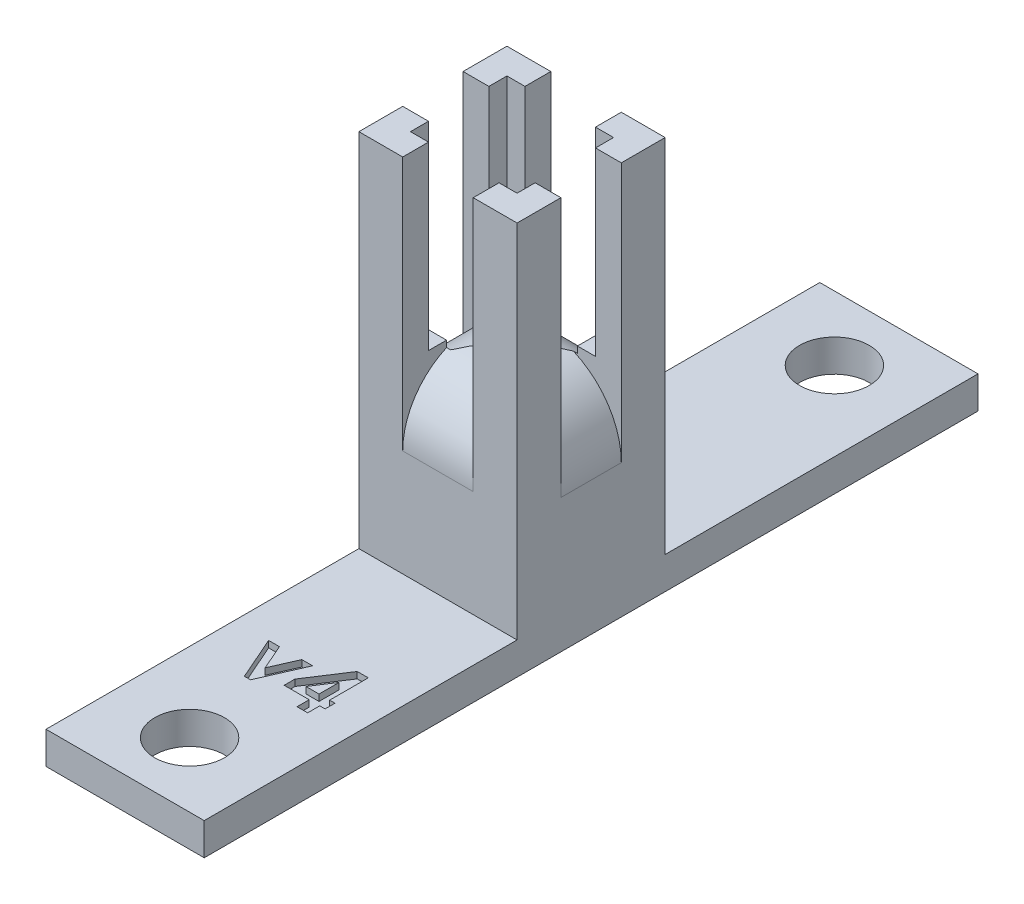
from build123d import *

# Parameters (mm, degrees)
BOSS_EXTRUDE1_DEPTH            = 17.78
BOSS_EXTRUDE1_2_DEPTH          = 17.78
BOSS_EXTRUDE1_3_DEPTH          = 17.78
BOSS_EXTRUDE1_4_DEPTH          = 17.78
SKETCH2_W                      = 15.58
SKETCH2_H                      = 14.58
BOSS_EXTRUDE2_DEPTH            = 17.78
SKETCH3_W                      = 15.58
SKETCH3_H                      = 76.2
SKETCH3_R                      = 3.429
BOSS_EXTRUDE3_DEPTH            = 3.175
CUT_EXTRUDE3_DEPTH             = 0.635
CUT_EXTRUDE4_REACH             = 46.175
CUT_EXTRUDE4_DIRECTION_2_REACH = 46.175
CUT_EXTRUDE5_REACH             = 46.175
CUT_EXTRUDE5_DIRECTION_2_REACH = 46.175


with BuildPart() as part:
    # Sketch1 → Boss-Extrude1 (new body)
    with BuildSketch(Plane(origin=(0, 0, 0), x_dir=(1, 0, 0), z_dir=(0, 1, 0))):
        Polygon((-5.25, 4.75), (-5.25, 2.972), (-7.79, 2.972), (-7.79, 7.29), (-3.472, 7.29), (-3.472, 4.75), align=None)
    extrude(amount=BOSS_EXTRUDE1_DEPTH)



with BuildPart() as body_2:
    # Sketch1 → Boss-Extrude1 2 (new body)
    with BuildSketch(Plane(origin=(0, 0, 0), x_dir=(1, 0, 0), z_dir=(0, 1, 0))):
        Polygon((7.79, 2.972), (7.79, 7.29), (3.472, 7.29), (3.472, 4.75), (5.25, 4.75), (5.25, 2.972), align=None)
    extrude(amount=BOSS_EXTRUDE1_2_DEPTH)


with BuildPart() as body_3:
    # Sketch1 → Boss-Extrude1 3 (new body)
    with BuildSketch(Plane(origin=(0, 0, 0), x_dir=(1, 0, 0), z_dir=(0, 1, 0))):
        Polygon((5.25, -2.972), (7.79, -2.972), (7.79, -7.29), (3.472, -7.29), (3.472, -4.75), (5.25, -4.75), align=None)
    extrude(amount=BOSS_EXTRUDE1_3_DEPTH)


with BuildPart() as body_4:
    # Sketch1 → Boss-Extrude1 4 (new body)
    with BuildSketch(Plane(origin=(0, 0, 0), x_dir=(1, 0, 0), z_dir=(0, 1, 0))):
        Polygon((-5.25, -2.972), (-7.79, -2.972), (-7.79, -7.29), (-3.472, -7.29), (-3.472, -4.75), (-5.25, -4.75), align=None)
    extrude(amount=BOSS_EXTRUDE1_4_DEPTH)


with BuildPart() as part_1:
    add(part.part)

    add(body_2.part)  # Boss-Extrude2 merges body 2

    add(body_3.part)  # Boss-Extrude2 merges body 3

    add(body_4.part)  # Boss-Extrude2 merges body 4
    # Sketch2 → Boss-Extrude2 (add)
    with BuildSketch(Plane(origin=(0, 0, 0), x_dir=(-1, 0, 0), z_dir=(0, -1, 0))):
        Rectangle(SKETCH2_W, SKETCH2_H)
    extrude(amount=BOSS_EXTRUDE2_DEPTH)

    # Sketch3 → Boss-Extrude3 (add)
    with BuildSketch(Plane(origin=(0, -17.78, 0), x_dir=(-1, 0, 0), z_dir=(0, -1, 0))):
        Rectangle(SKETCH3_W, SKETCH3_H)
        with Locations(Location((0, 31.75, 0), (0, 0, 90))):
            Circle(SKETCH3_R, mode=Mode.SUBTRACT)
        with Locations(Location((0, -31.75, 0), (0, 0, 270))):
            Circle(SKETCH3_R, mode=Mode.SUBTRACT)
    extrude(amount=BOSS_EXTRUDE3_DEPTH)

    # Sketch5 → Cut-Extrude3 (cut)
    # profile 1 of 2: a face of its own
    with BuildSketch(Plane(origin=(0, -17.78, 0), x_dir=(1, 0, 0), z_dir=(0, 1, 0))):
        Polygon((-4.402938034, -19.56265828), (-3.33951656, -19.56265828), (-2.238782051, -22.073125862), (-1.138047543, -19.56265828), (-0.074626068, -19.56265828), (-1.937945713, -23.816344178), (-2.539618389, -23.816344178), align=None)
    # profile 2 of 2: a face of its own
    with BuildSketch(Plane(origin=(0, -17.78, 0), x_dir=(1, 0, 0), z_dir=(0, 1, 0))):
        Polygon((2.604916199, -17.846258707), (3.693990385, -17.846258707), (3.693990385, -21.652188195), (4.216372863, -21.652188195), (4.216372863, -22.622327084), (3.693990385, -22.622327084), (3.693990385, -23.816344178), (2.649225427, -23.816344178), (2.649225427, -22.622327084), (0.186565171, -22.622327084), (0.186565171, -21.564735771), align=None)
        Polygon((2.649225427, -21.652188195), (2.649225427, -19.671099286), (1.360759716, -21.652188195), align=None, mode=Mode.SUBTRACT)
    extrude(amount=-CUT_EXTRUDE3_DEPTH, mode=Mode.SUBTRACT)

    # Cut-Extrude4: up to this face of the body (flat: up to its plane)
    cut_extrude4_end = Plane(part_1.part.faces().sort_by_distance((-3.472, 8.89, 6.02))[0])
    # Sketch6 → Cut-Extrude4 (cut, up to the picked face)
    with BuildSketch(Plane(origin=(0, 0, 0), x_dir=(0, 0, -1), z_dir=(1, 0, 0)), mode=Mode.PRIVATE) as cut_extrude4_sk1:
        with BuildLine():
            Line((-7.29, -7.29), (-7.29, 2.54))
            Line((-7.29, 2.54), (7.29, 2.54))
            Line((7.29, 2.54), (7.29, -7.29))
            ThreePointArc((7.29, -7.29), (0, 0), (-7.29, -7.29))
        make_face()
    cut_extrude4_tool1 = split(extrude(cut_extrude4_sk1.sketch, amount=-CUT_EXTRUDE4_REACH, mode=Mode.PRIVATE), bisect_by=cut_extrude4_end, keep=Keep.BOTH, mode=Mode.PRIVATE)
    add(cut_extrude4_tool1.solids().sort_by(Axis((0, 0.165267, 0), (-1, 0, 0)))[0], mode=Mode.SUBTRACT)

    # Cut-Extrude4 direction 2: up to this face of the body (flat: up to its plane)
    cut_extrude4_direction_2_end = Plane(part_1.part.faces().sort_by_distance((3.472, 8.89, 6.02))[0])
    # Sketch6 → Cut-Extrude4 direction 2 (cut, up to the picked face)
    with BuildSketch(Plane(origin=(0, 0, 0), x_dir=(0, 0, -1), z_dir=(1, 0, 0)), mode=Mode.PRIVATE) as cut_extrude4_direction_2_sk1:
        with BuildLine():
            Line((-7.29, -7.29), (-7.29, 2.54))
            Line((-7.29, 2.54), (7.29, 2.54))
            Line((7.29, 2.54), (7.29, -7.29))
            ThreePointArc((7.29, -7.29), (0, 0), (-7.29, -7.29))
        make_face()
    cut_extrude4_direction_2_tool1 = split(extrude(cut_extrude4_direction_2_sk1.sketch, amount=CUT_EXTRUDE4_DIRECTION_2_REACH, mode=Mode.PRIVATE), bisect_by=cut_extrude4_direction_2_end, keep=Keep.BOTH, mode=Mode.PRIVATE)
    add(cut_extrude4_direction_2_tool1.solids().sort_by(Axis((0, 0.165267, 0), (1, 0, 0)))[0], mode=Mode.SUBTRACT)

    # Cut-Extrude5: up to this face of the body (flat: up to its plane)
    cut_extrude5_end = Plane(part_1.part.faces().sort_by_distance((-6.52, 8.89, -2.972))[0])
    # Sketch7 → Cut-Extrude5 (cut, up to the picked face)
    with BuildSketch(Plane.XY, mode=Mode.PRIVATE) as cut_extrude5_sk1:
        with BuildLine():
            Line((-7.79, -7.79), (-7.79, 4.538671937))
            Line((-7.79, 4.538671937), (7.79, 4.538671937))
            Line((7.79, 4.538671937), (7.79, -7.79))
            ThreePointArc((7.79, -7.79), (0, 0), (-7.79, -7.79))
        make_face()
    cut_extrude5_tool1 = split(extrude(cut_extrude5_sk1.sketch, amount=-CUT_EXTRUDE5_REACH, mode=Mode.PRIVATE), bisect_by=cut_extrude5_end, keep=Keep.BOTH, mode=Mode.PRIVATE)
    add(cut_extrude5_tool1.solids().sort_by(Axis((0, 1.190075, 0), (0, 0, -1)))[0], mode=Mode.SUBTRACT)

    # Cut-Extrude5 direction 2: up to this face of the body (flat: up to its plane)
    cut_extrude5_direction_2_end = Plane(part_1.part.faces().sort_by_distance((-6.52, 8.89, 2.972))[0])
    # Sketch7 → Cut-Extrude5 direction 2 (cut, up to the picked face)
    with BuildSketch(Plane.XY, mode=Mode.PRIVATE) as cut_extrude5_direction_2_sk1:
        with BuildLine():
            Line((-7.79, -7.79), (-7.79, 4.538671937))
            Line((-7.79, 4.538671937), (7.79, 4.538671937))
            Line((7.79, 4.538671937), (7.79, -7.79))
            ThreePointArc((7.79, -7.79), (0, 0), (-7.79, -7.79))
        make_face()
    cut_extrude5_direction_2_tool1 = split(extrude(cut_extrude5_direction_2_sk1.sketch, amount=CUT_EXTRUDE5_DIRECTION_2_REACH, mode=Mode.PRIVATE), bisect_by=cut_extrude5_direction_2_end, keep=Keep.BOTH, mode=Mode.PRIVATE)
    add(cut_extrude5_direction_2_tool1.solids().sort_by(Axis((0, 1.190075, 0), (0, 0, 1)))[0], mode=Mode.SUBTRACT)


solid = part_1.part
